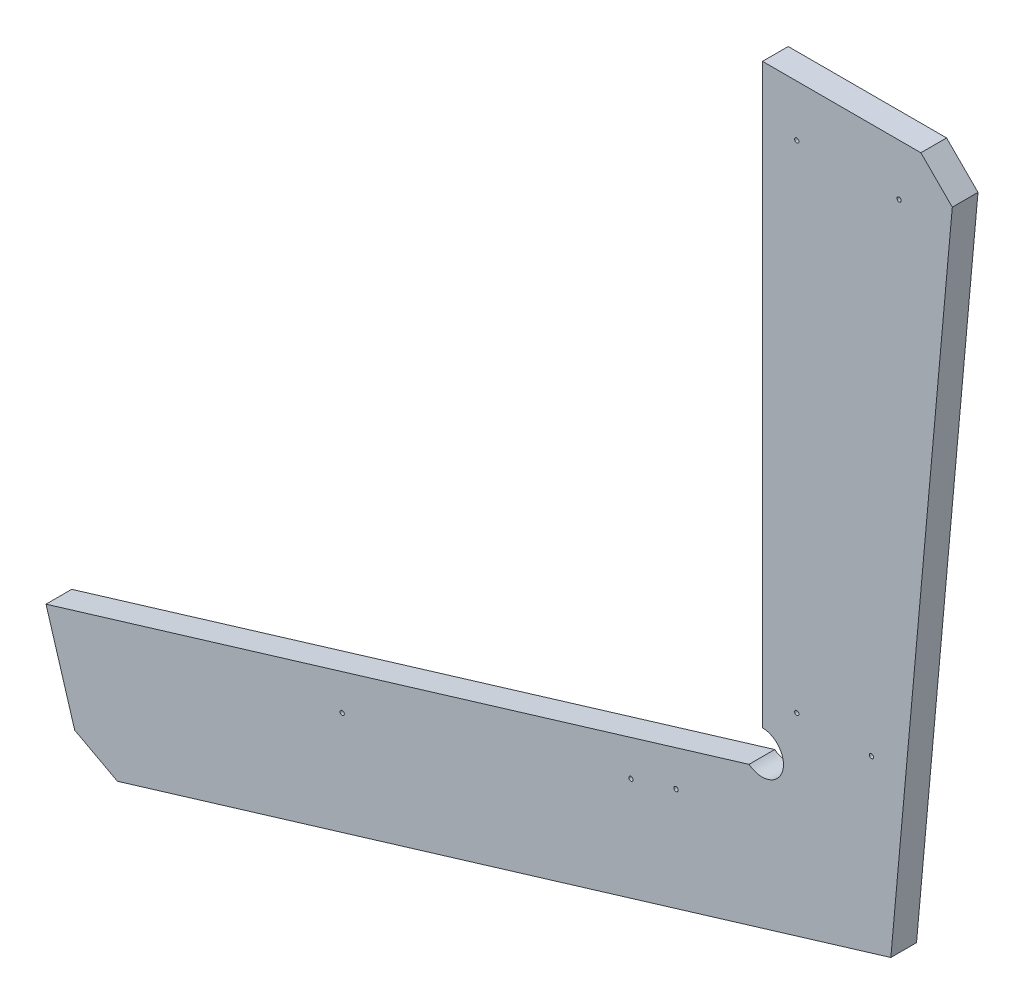
from build123d import *
from OCP.BRepFilletAPI import BRepFilletAPI_MakeChamfer

# Parameters (mm, degrees)
BOSS_EXTRUDE1_DEPTH = 19.05
CHAMFER1_SIZE       = 25.4
CHAMFER1_SIZE2      = 23.3906272
HOLE5_D             = 3.175
HOLE5_DEPTH         = 38.1
HOLE5_CSINK_D       = 10.16
HOLE5_CSINK_ANGLE   = 82
HOLE5_TIP           = 0.953866233
HOLE6_D             = 3.175
HOLE6_DEPTH         = 38.1
HOLE6_CSINK_D       = 10.16
HOLE6_CSINK_ANGLE   = 82
HOLE6_TIP           = 0.953866233


with BuildPart() as part:
    # Sketch1 → Boss-Extrude1 (new body)
    with BuildSketch(Plane.XY):
        with BuildLine():
            Line((12.7, 12.7), (12.7, -415.185594934))
            ThreePointArc((12.7, -415.185594934), (27.339445595, -436.32629993), (2.687239133, -443.641454859))
            Line((2.687239133, -443.641454859), (-518.461959982, -601.369999539))
            Line((-518.461959982, -601.369999539), (-489.829069295, -695.97562771))
            Line((-489.829069295, -695.97562771), (107.818813597, -515.094354248))
            Line((107.818813597, -515.094354248), (155.492294041, 12.7))
            Line((155.492294041, 12.7), (12.7, 12.7))
        make_face()
    extrude(amount=-BOSS_EXTRUDE1_DEPTH)

    # Chamfer1: one chamfer whose edges measure the first distance from different faces: ONE call of the kernel's chamfer builder (chamfer() names one face for all edges)
    chamfer1_edges_1 = [part.edges().sort_by_distance(p)[0] for p in [
        (155.492294041, 12.7, -9.525),
    ]]
    chamfer1_side_1 = [part.faces().sort_by_distance(p)[0] for p in [
        (84.09614702, 12.7, -9.525),
    ]]
    chamfer1_edges_2 = [part.edges().sort_by_distance(p)[0] for p in [
        (-489.829069295, -695.97562771, -9.525),
    ]]
    chamfer1 = BRepFilletAPI_MakeChamfer(part.part.solid().wrapped)
    for e in chamfer1_edges_1:
        chamfer1.Add(CHAMFER1_SIZE, CHAMFER1_SIZE2, e.wrapped, chamfer1_side_1[0].wrapped)  # the first distance lies on this face
    for e in chamfer1_edges_2:
        chamfer1.Add(CHAMFER1_SIZE, e.wrapped)
    add(Compound.cast(chamfer1.Shape()), mode=Mode.REPLACE)

    # Hole5
    with Locations(Plane(origin=(155.286738577, 10.424290059, -19.05), x_dir=(-0.08995962873759064, -0.9959454127598535, 0), z_dir=(0, 0, -1))):
        with Locations((46.221112845, 113.488854888), (39.39759596, 37.945520226), (412.28786892, 80.423559293), (407.308516105, 25.297013484), (513.561319184, 161.164706775), (597.46020397, 127.267357003), (610.543339245, 159.649253123), (694.322923815, 367.011001477), (526.644454459, 193.546602895), (610.424039029, 400.908351249)):
            CounterSinkHole(HOLE5_D / 2, HOLE5_CSINK_D / 2, depth=HOLE5_DEPTH, counter_sink_angle=HOLE5_CSINK_ANGLE)
            with Locations((0, 0, -(HOLE5_DEPTH + HOLE5_TIP / 2))):  # 118° drill point
                Cone(0, HOLE5_D / 2, HOLE5_TIP, mode=Mode.SUBTRACT)

    # Hole6
    with Locations(Plane(origin=(-643.705760022, -231.394989772, 165.474999994), x_dir=(0, 0, -1), z_dir=(-0.9571239768071421, -0.2896786029738502, -1.2569443472852944e-15))):
        with Locations((-108.649999997, 332.89193461), (108.649999997, 332.89193461), (207.774999994, 332.89193461), (174.999999994, 448.336332751), (135.266666663, 384.042401694), (176.283333328, 384.042401694), (-174.999999994, 448.336332751), (-135.266666663, 384.042401694), (-176.283333328, 384.042401694), (-207.774999994, 332.89193461)):
            CounterSinkHole(HOLE6_D / 2, HOLE6_CSINK_D / 2, depth=HOLE6_DEPTH, counter_sink_angle=HOLE6_CSINK_ANGLE)
            with Locations((0, 0, -(HOLE6_DEPTH + HOLE6_TIP / 2))):  # 118° drill point
                Cone(0, HOLE6_D / 2, HOLE6_TIP, mode=Mode.SUBTRACT)


solid = part.part
